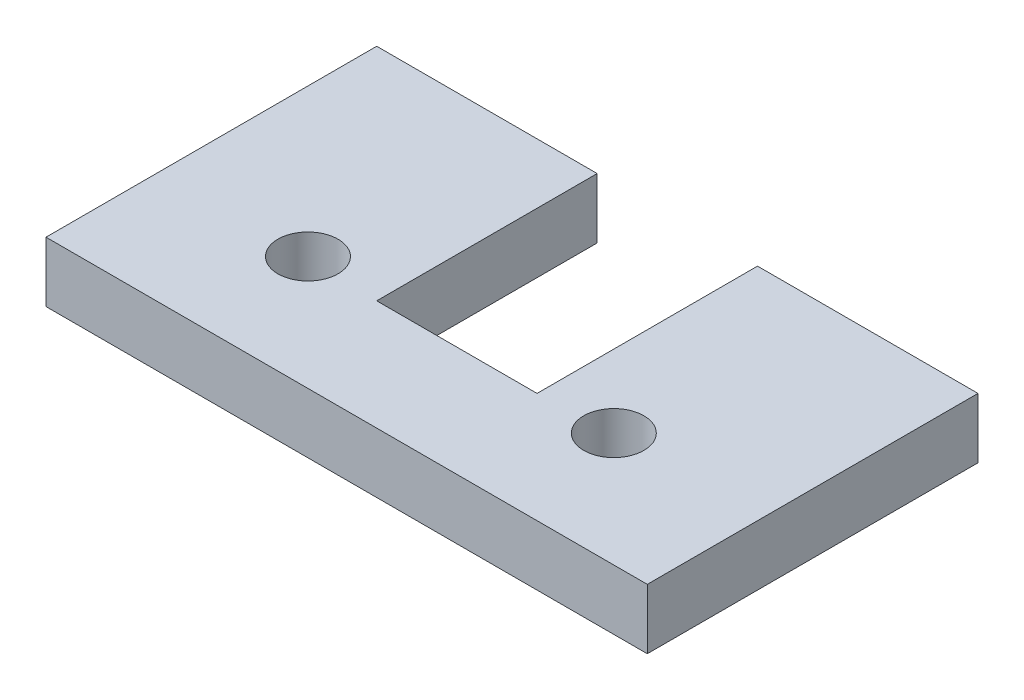
from build123d import *

# Parameters (mm, degrees)
SKETCH1_R           = 1.5
BOSS_EXTRUDE1_DEPTH = 3


with BuildPart() as part:
    # Sketch1 → Boss-Extrude1 (new body)
    with BuildSketch(Plane(origin=(0, 0, 0), x_dir=(1, 0, 0), z_dir=(0, 1, 0))):
        Polygon((11, 0), (0, 0), (0, -11), (-8, -11), (-8, 0), (-19, 0), (-19, -16.5), (11, -16.5), align=None)
        with Locations(Location((-11.63, -10.8, 0), (0, 0, 270))):
            Circle(SKETCH1_R, mode=Mode.SUBTRACT)
        with Locations(Location((3.63, -10.8, 0), (0, 0, 270))):
            Circle(SKETCH1_R, mode=Mode.SUBTRACT)
    extrude(amount=BOSS_EXTRUDE1_DEPTH)


solid = part.part
